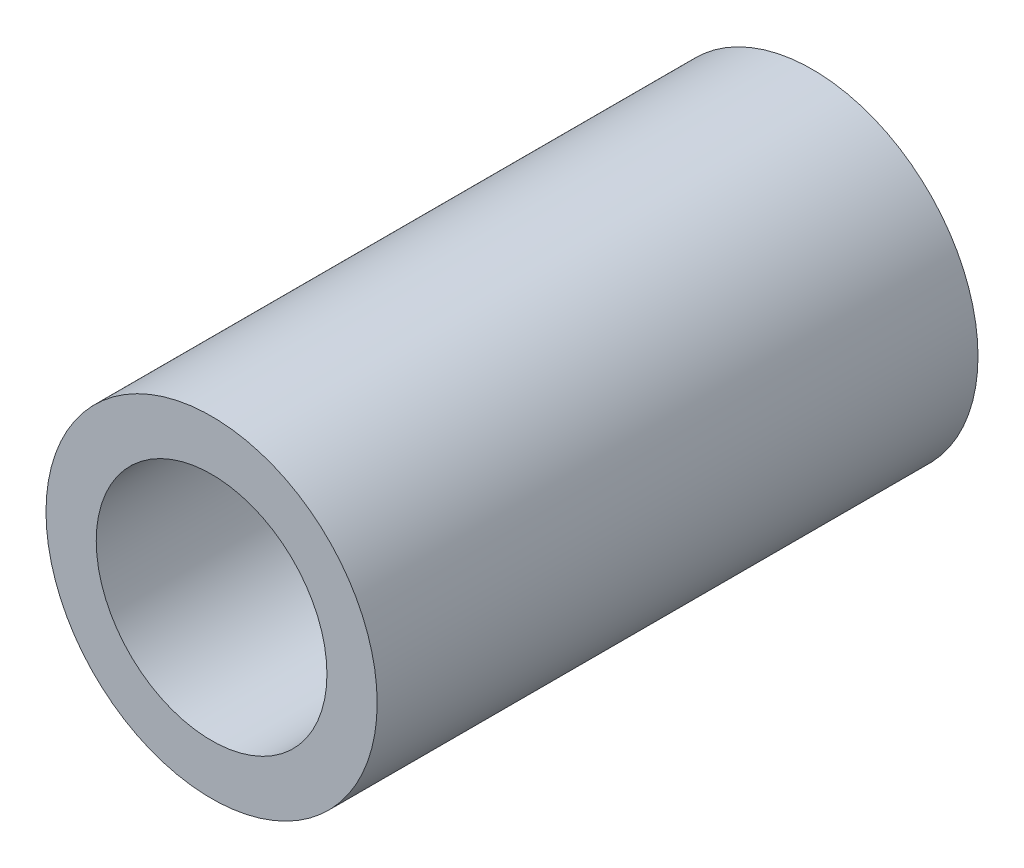
from build123d import *

# Parameters (mm, degrees)
SKETCH1_R             = 1.75
BOSS_EXTRUDE1_DEPTH   = 6.35
F_4_CLEARANCE_HOLE1_D = 2.4384


with BuildPart() as part:
    # Sketch1 → Boss-Extrude1 (new body)
    with BuildSketch(Plane.XY):
        Circle(SKETCH1_R)
    extrude(amount=BOSS_EXTRUDE1_DEPTH)

    # #4 Clearance Hole1 (through all)
    with Locations(Plane(origin=(0, 0, 0), x_dir=(-1, 0, 0), z_dir=(0, 0, -1))):
        with Locations((0, 0)):
            Hole(F_4_CLEARANCE_HOLE1_D / 2)


solid = part.part
